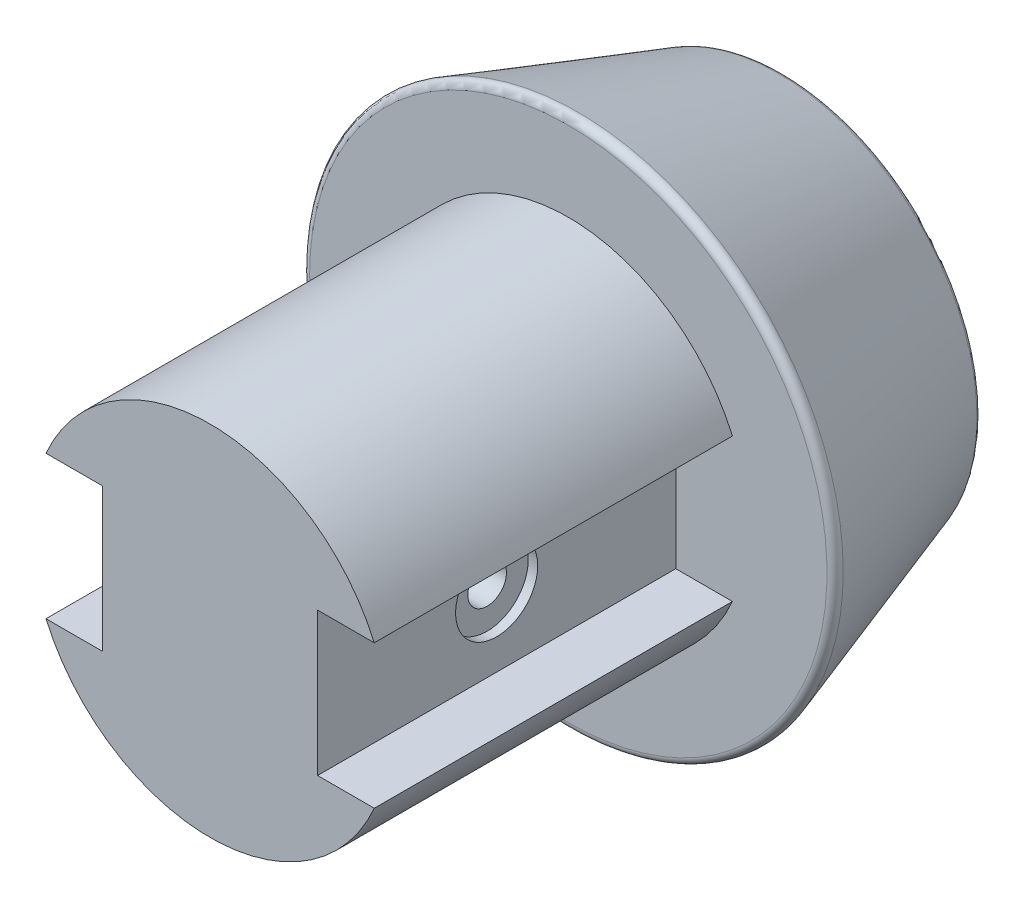
from build123d import *

# Parameters (mm, degrees)
BOSS_EXTRUDE1_DEPTH                             = 12.7
SKETCH2_R                                       = 9.525
SKETCH3_R                                       = 6.985
FILLET1_R                                       = 0.254
CUT_EXTRUDE1_DEPTH                              = 2.54
CUT_EXTRUDE1_DEPTH_BACK                         = 19.412260753
SKETCH4_R                                       = 2.286
SCALE1_SCALE                                    = 1.5
CBORE_FOR_1_PAN_HEAD_MACHINE_SCREW2_D           = 2.0574
CBORE_FOR_1_PAN_HEAD_MACHINE_SCREW2_CBORE_D     = 4.36626
CBORE_FOR_1_PAN_HEAD_MACHINE_SCREW2_CBORE_DEPTH = 0.508


with BuildPart() as part:
    # Sketch1 → Boss-Extrude1 (new body)
    with BuildSketch(Plane.XY):
        with BuildLine():
            ThreePointArc((5.819871133, 2.54), (0, 6.35), (-5.819871133, 2.54))
            Line((-5.819871133, 2.54), (-3.81, 2.54))
            Line((-3.81, 2.54), (-3.81, -2.54))
            Line((-3.81, -2.54), (-5.819871133, -2.54))
            ThreePointArc((-5.819871133, -2.54), (0, -6.35), (5.819871133, -2.54))
            Line((5.819871133, -2.54), (3.81, -2.54))
            Line((3.81, -2.54), (3.81, 2.54))
            Line((3.81, 2.54), (5.819871133, 2.54))
        make_face()
    extrude(amount=BOSS_EXTRUDE1_DEPTH)

    # Sketch2 → Loft1 section 0
    with BuildSketch(Plane(origin=(0, 0, 0), x_dir=(-1, 0, 0), z_dir=(0, 0, -1))):
        Circle(SKETCH2_R)
    # Sketch3 → Loft1 section 1
    with BuildSketch(Plane.XY.offset(-7.62)):
        Circle(SKETCH3_R)
    loft()

    # Fillet1
    fillet1_edges = [part.edges().sort_by_distance(p)[0] for p in [
        (9.525, 0, 0),
        (6.985, 0, -7.62),
    ]]
    fillet(fillet1_edges, radius=FILLET1_R)

    # Sketch4 → Cut-Extrude1 (cut, two sides: drawn at the far end of the back side and taken through both)
    with BuildSketch(Plane(origin=(0, 0, 0), x_dir=(1, 0, 0), z_dir=(0, 1, 0)).offset(-CUT_EXTRUDE1_DEPTH_BACK)):
        with Locations(Location((0, -6.35, 0), (0, 0, 90))):
            Circle(SKETCH4_R)
    extrude(amount=CUT_EXTRUDE1_DEPTH + CUT_EXTRUDE1_DEPTH_BACK, mode=Mode.SUBTRACT)


with BuildPart() as part_1:
    # Scale1: scaled about (5.44e-07, 0.095418274, 0.619819033)
    add(part.part.scale(SCALE1_SCALE).moved(Location((-2.72e-07, -0.047709137, -0.309909516))))

    # CBORE for #1 Pan Head Machine Screw2 (through all)
    with Locations(Plane(origin=(5.715002511, 0, 0), x_dir=(0, 0, -1), z_dir=(1, 0, 0))):
        with Locations((-9.2150808, -0.047706209)):
            cbore_for_1_pan_head_machine_screw2 = CounterBoreHole(CBORE_FOR_1_PAN_HEAD_MACHINE_SCREW2_D / 2, CBORE_FOR_1_PAN_HEAD_MACHINE_SCREW2_CBORE_D / 2, CBORE_FOR_1_PAN_HEAD_MACHINE_SCREW2_CBORE_DEPTH)

    # Mirror1: CBORE for #1 Pan Head Machine Screw2 across plane
    add(cbore_for_1_pan_head_machine_screw2.mirror(Plane(origin=(0, 0, 0), x_dir=(0, 0, 1), z_dir=(1, 0, 0))), mode=Mode.SUBTRACT)


solid = part_1.part
